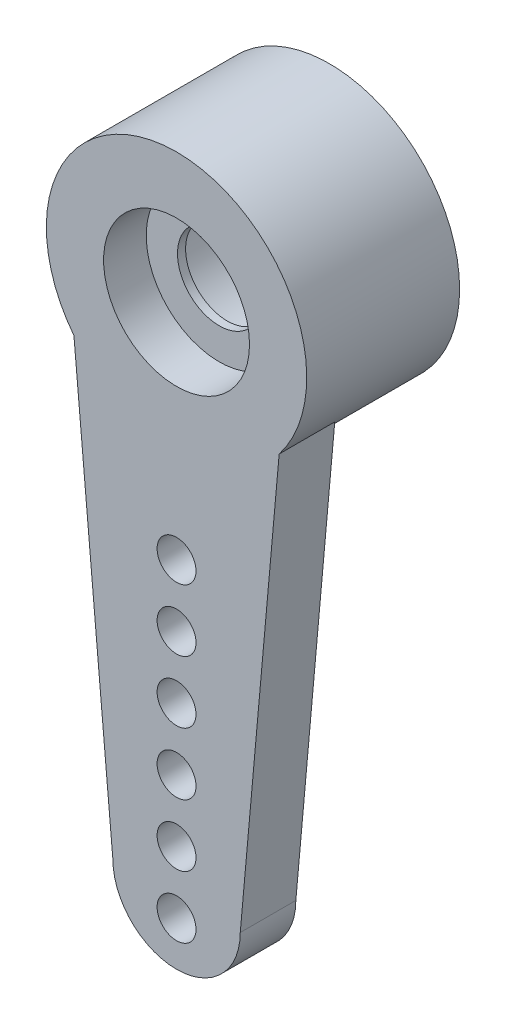
from build123d import *

# Parameters (mm, degrees)
SKETCH1_R           = 3.5687
SKETCH1_R_2         = 2
BOSS_EXTRUDE1_DEPTH = 4.191
SKETCH5_R           = 2
SKETCH5_R_2         = 1.143
BOSS_EXTRUDE2_DEPTH = 0.2226
BOSS_EXTRUDE3_START = -1.524
SKETCH6_R           = 0.5334
BOSS_EXTRUDE3_DEPTH = 1.524
SCALE1_SCALE        = 0.1


with BuildPart() as part:
    # Sketch1 → Boss-Extrude1 (new body)
    with BuildSketch(Plane.XY.offset(-7.032965862)):
        with Locations((-5.5, 0)):
            Circle(SKETCH1_R)
        with Locations((-5.5, 0)):
            Circle(SKETCH1_R_2, mode=Mode.SUBTRACT)
    extrude(amount=BOSS_EXTRUDE1_DEPTH)

    # Sketch5 → Boss-Extrude2 (add)
    with BuildSketch(Plane.XY.offset(-4.232965862)):
        with Locations((-5.5, 0)):
            Circle(SKETCH5_R)
        with Locations((-5.5, 0)):
            Circle(SKETCH5_R_2, mode=Mode.SUBTRACT)
    extrude(amount=BOSS_EXTRUDE2_DEPTH)

    # Sketch6 → Boss-Extrude3 (add)
    with BuildSketch(Plane.XY.offset(-2.841965862).offset(BOSS_EXTRUDE3_START)):
        with BuildLine():
            Line((-3.75375, -14.09065), (-2.68695, -2.195989387))
            ThreePointArc((-2.68695, -2.195989387), (-5.5, -3.5687), (-8.31305, -2.195989387))
            Line((-8.31305, -2.195989387), (-7.24625, -14.09065))
            ThreePointArc((-7.24625, -14.09065), (-5.5, -15.8369), (-3.75375, -14.09065))
        make_face()
        with Locations((-5.5, -12.92225)):
            Circle(SKETCH6_R, mode=Mode.SUBTRACT)
        with Locations((-5.5, -14.62405)):
            Circle(SKETCH6_R, mode=Mode.SUBTRACT)
        with Locations((-5.5, -11.22045)):
            Circle(SKETCH6_R, mode=Mode.SUBTRACT)
        with Locations((-5.5, -9.51865)):
            Circle(SKETCH6_R, mode=Mode.SUBTRACT)
        with Locations((-5.5, -7.81685)):
            Circle(SKETCH6_R, mode=Mode.SUBTRACT)
        with Locations((-5.5, -6.11505)):
            Circle(SKETCH6_R, mode=Mode.SUBTRACT)
    extrude(amount=BOSS_EXTRUDE3_DEPTH)


with BuildPart() as part_1:
    # Scale1: scaled about (-5.5, -3.337046633, -4.414341791)
    add(part.part.scale(SCALE1_SCALE).moved(Location((-4.95, -3.00334197, -3.972907612))))


solid = part_1.part
